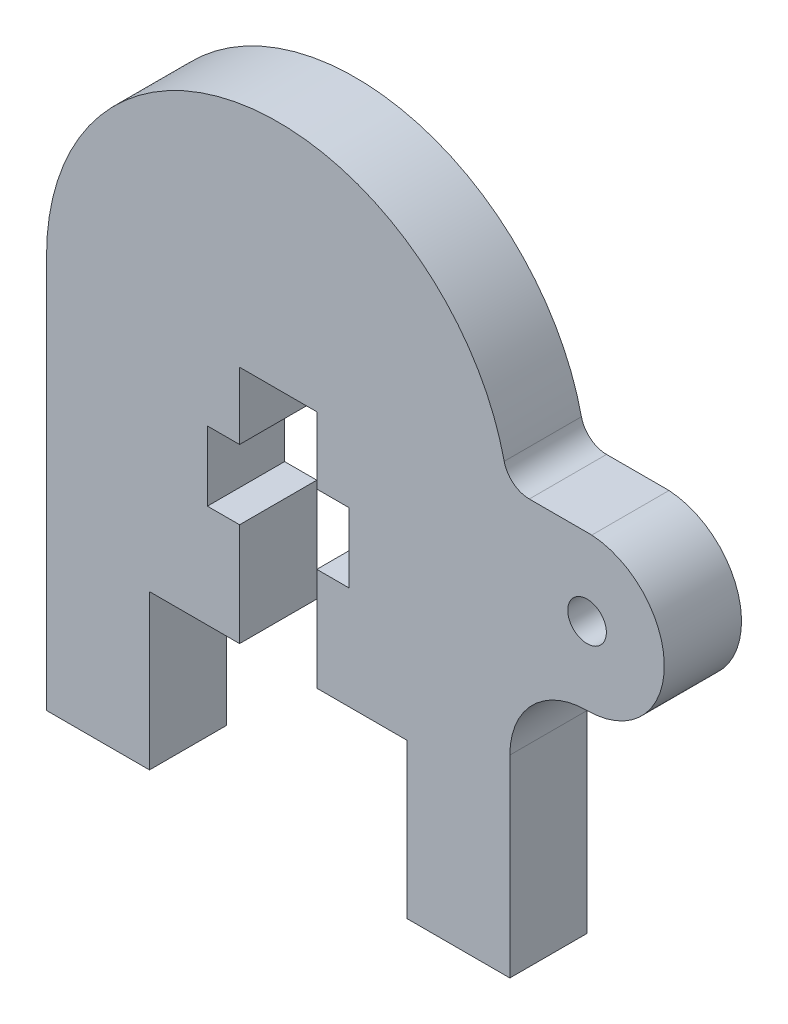
from build123d import *

# Parameters (mm, degrees)
SKETCH_1_R      = 0.75
EXTRUDE_1_DEPTH = 3


with BuildPart() as part:
    # 草图1 → 凸台-拉伸1 (new body)
    with BuildSketch(Plane.XY):
        with BuildLine():
            Line((0, 0), (4, 0))
            Line((4, 0), (4, 6))
            Line((4, 6), (7.5, 6))
            Line((7.5, 6), (7.5, 10))
            Line((7.5, 10), (6.25, 10))
            Line((6.25, 10), (6.25, 12.7))
            Line((6.25, 12.7), (7.5, 12.7))
            Line((7.5, 12.7), (7.5, 15.3))
            Line((7.5, 15.3), (10.5, 15.3))
            Line((10.5, 15.3), (10.5, 12.7))
            Line((10.5, 12.7), (11.75, 12.7))
            Line((11.75, 12.7), (11.75, 10))
            Line((11.75, 10), (10.5, 10))
            Line((10.5, 10), (10.5, 6))
            Line((10.5, 6), (14, 6))
            Line((14, 6), (14, 0))
            Line((14, 0), (18, 0))
            Line((18, 0), (18, 7.5))
            ThreePointArc((18, 7.5), (18.878679656, 9.621320344), (21, 10.5))
            ThreePointArc((21, 10.5), (23.998598833, 13.408321005), (21.183272352, 16.494396641))
            Line((21.183272352, 16.494396641), (18.756260727, 16.494396641))
            ThreePointArc((18.756260727, 16.494396641), (18.131536654, 16.713551053), (17.780634655, 17.274956977))
            ThreePointArc((17.780634655, 17.274956977), (8.006448766, 24.24499055), (0, 15.3))
            Line((0, 15.3), (0, 0))
        make_face()
        with Locations((21, 13.5)):
            Circle(SKETCH_1_R, mode=Mode.SUBTRACT)
    extrude(amount=EXTRUDE_1_DEPTH)


solid = part.part
